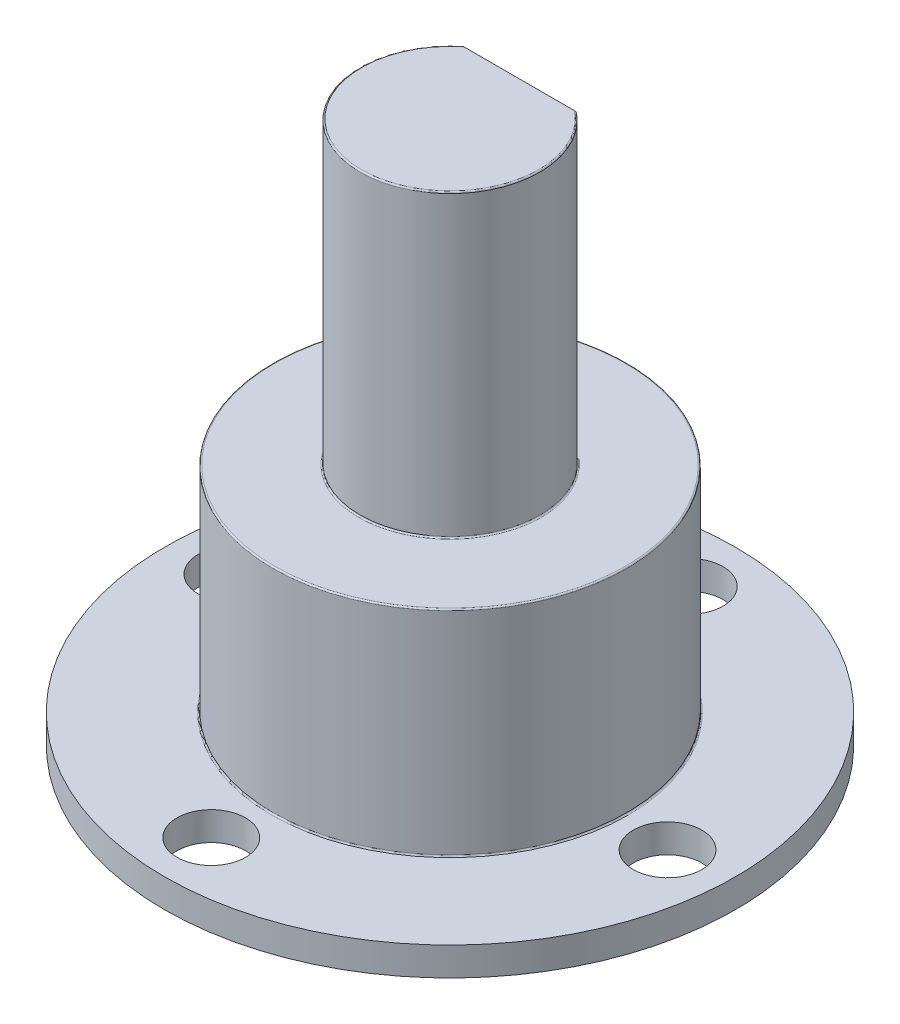
from build123d import *

# Parameters (mm, degrees)
ESQUISSE3_W                  = 6.57785754
ESQUISSE3_H                  = 1.386048805
ENL_V_MAT_EXTRU_1_DEPTH      = 10.5
D_GAGEMENT_M21_D             = 2.4
R_P_TITION_CIRCULAIRE1_COUNT = 4
CONG_1_R                     = 0.05


with BuildPart() as part:
    # Esquisse2 → Révolution2 (revolve)
    with BuildSketch(Plane.XY, mode=Mode.PRIVATE) as r_volution2_sk:
        Polygon((0, 19), (3.15, 19), (3.15, 8.5), (6.2, 8.5), (6.2, 3), (6.2, 1), (10, 1), (10, 0), (4.5, 0), (4.5, 5), (0, 5), align=None)
    revolve(r_volution2_sk.sketch.rotate(Axis((0, 5, 0), (0, 1, 0)), 90), axis=Axis((0, 5, 0), (0, 1, 0)))

    # Esquisse3 → Enlèv. mat.-Extru.1 (cut)
    with BuildSketch(Plane(origin=(0, 19, 0), x_dir=(1, 0, 0), z_dir=(0, 1, 0))):
        with Locations((-0.352413472, 3.114928535)):
            Rectangle(ESQUISSE3_W, ESQUISSE3_H)
    extrude(amount=-ENL_V_MAT_EXTRU_1_DEPTH, mode=Mode.SUBTRACT)

    # Dégagement M21 (through all)
    with Locations(Plane(origin=(0, 1, 0), x_dir=(1, 0, 0), z_dir=(0, 1, 0))):
        with Locations((0.371303159, 7.991378727)):
            d_gagement_m21 = Hole(D_GAGEMENT_M21_D / 2)

    # Répétition circulaire1: Dégagement M21 ×4 about axis
    r_p_tition_circulaire1_axis = Axis((0, 0, 0), (0, 1, 0))
    for i in range(1, R_P_TITION_CIRCULAIRE1_COUNT):
        add(d_gagement_m21.rotate(r_p_tition_circulaire1_axis, i * 360 / R_P_TITION_CIRCULAIRE1_COUNT), mode=Mode.SUBTRACT)

    # Congé1
    cong_1_edges = [part.edges().sort_by_distance(p)[0] for p in [
        (0, 8.5, 6.2),
        (0, 8.5, 3.15),
        (0, 19, 3.15),
        (0, 1, 6.2),
    ]]
    fillet(cong_1_edges, radius=CONG_1_R)


solid = part.part
